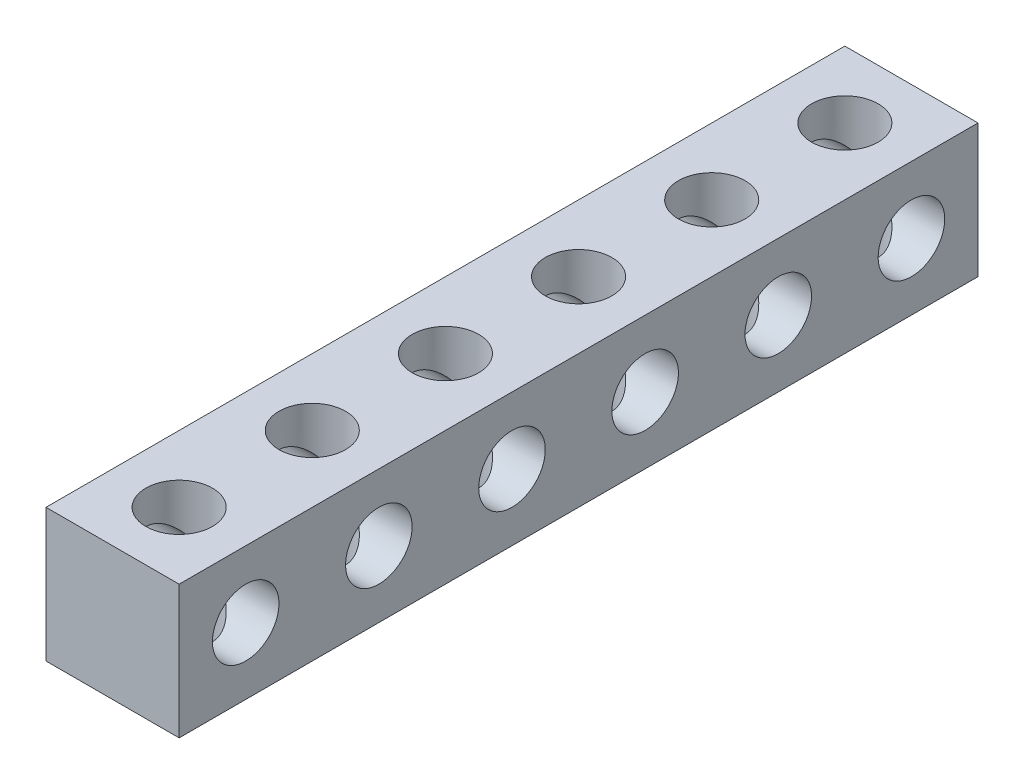
from build123d import *

# Parameters (mm, degrees)
SKETCH1_W           = 12.7
SKETCH1_H           = 12.7
BOSS_EXTRUDE1_DEPTH = 38.1
SKETCH2_R           = 3.175
CUT_EXTRUDE1_DEPTH  = 41.659838908
SKETCH4_R           = 3.175
CUT_EXTRUDE2_DEPTH  = 41.659838908


with BuildPart() as part:
    # Sketch1 → Boss-Extrude1 (new, symmetric)
    with BuildSketch(Plane.XY):
        Rectangle(SKETCH1_W, SKETCH1_H)
    extrude(amount=BOSS_EXTRUDE1_DEPTH, both=True)

    # Sketch2 → Cut-Extrude1 (cut, through all)
    with BuildSketch(Plane(origin=(0, 6.35, 0), x_dir=(1, 0, 0), z_dir=(0, 1, 0))):
        with Locations(Location((0, 31.75, 0), (0, 0, 270))):
            Circle(SKETCH2_R)
        with Locations(Location((0, 19.05, 0), (0, 0, 270))):
            Circle(SKETCH2_R)
        with Locations(Location((0, 6.35, 0), (0, 0, 270))):
            Circle(SKETCH2_R)
        with Locations(Location((0, -6.35, 0), (0, 0, 270))):
            Circle(SKETCH2_R)
        with Locations(Location((0, -19.05, 0), (0, 0, 270))):
            Circle(SKETCH2_R)
        with Locations(Location((0, -31.75, 0), (0, 0, 270))):
            Circle(SKETCH2_R)
    extrude(amount=-CUT_EXTRUDE1_DEPTH, mode=Mode.SUBTRACT)

    # Sketch4 → Cut-Extrude2 (cut, through all)
    with BuildSketch(Plane.ZY.offset(6.35)):
        with Locations((31.75, 0)):
            Circle(SKETCH4_R)
        with Locations((19.05, 0)):
            Circle(SKETCH4_R)
        with Locations((6.35, 0)):
            Circle(SKETCH4_R)
        with Locations((-6.35, 0)):
            Circle(SKETCH4_R)
        with Locations((-19.05, 0)):
            Circle(SKETCH4_R)
        with Locations((-31.75, 0)):
            Circle(SKETCH4_R)
    extrude(amount=-CUT_EXTRUDE2_DEPTH, mode=Mode.SUBTRACT)


solid = part.part
